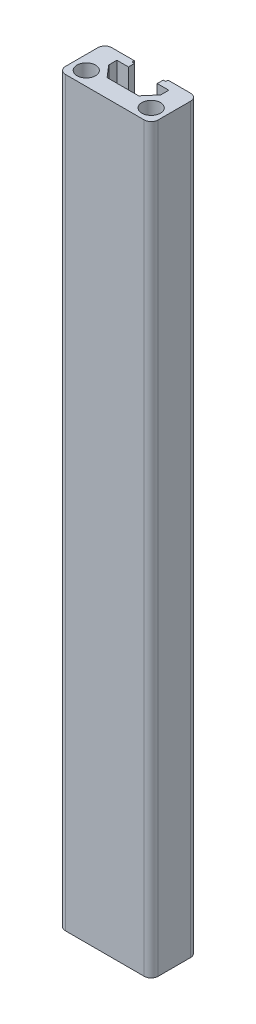
from build123d import *

# Parameters (mm, degrees)
SKETCH_1_R      = 2
EXTRUDE_1_DEPTH = 160
FILLET_1_R      = 1.5


with BuildPart() as part:
    # 草图1 → 凸台-拉伸1 (new body)
    with BuildSketch(Plane(origin=(0, 0, 0), x_dir=(1, 0, 0), z_dir=(0, 1, 0))):
        Polygon((0, 0), (20, 0), (20, 10), (13.65, 10), (13.65, 9.510427602), (13.1, 9.510427602), (13.1, 8.2), (15.6, 8.2), (15.6, 6.447507136), (13.412706863, 3.9), (6.587293137, 3.9), (4.4, 6.447507136), (4.4, 8.2), (6.9, 8.2), (6.9, 9.510427602), (6.35, 9.510427602), (6.35, 10), (0, 10), align=None)
        with Locations(Location((3, 3, 0), (0, 0, 270))):
            Circle(SKETCH_1_R, mode=Mode.SUBTRACT)
        with Locations(Location((17, 3, 0), (0, 0, 270))):
            Circle(SKETCH_1_R, mode=Mode.SUBTRACT)
    extrude(amount=EXTRUDE_1_DEPTH)

    # 圆角1
    fillet_1_edges = [part.edges().sort_by_distance(p)[0] for p in [
        (0, 80, -10),
        (20, 80, -10),
        (20, 80, 0),
        (0, 80, 0),
    ]]
    fillet(fillet_1_edges, radius=FILLET_1_R)


solid = part.part
